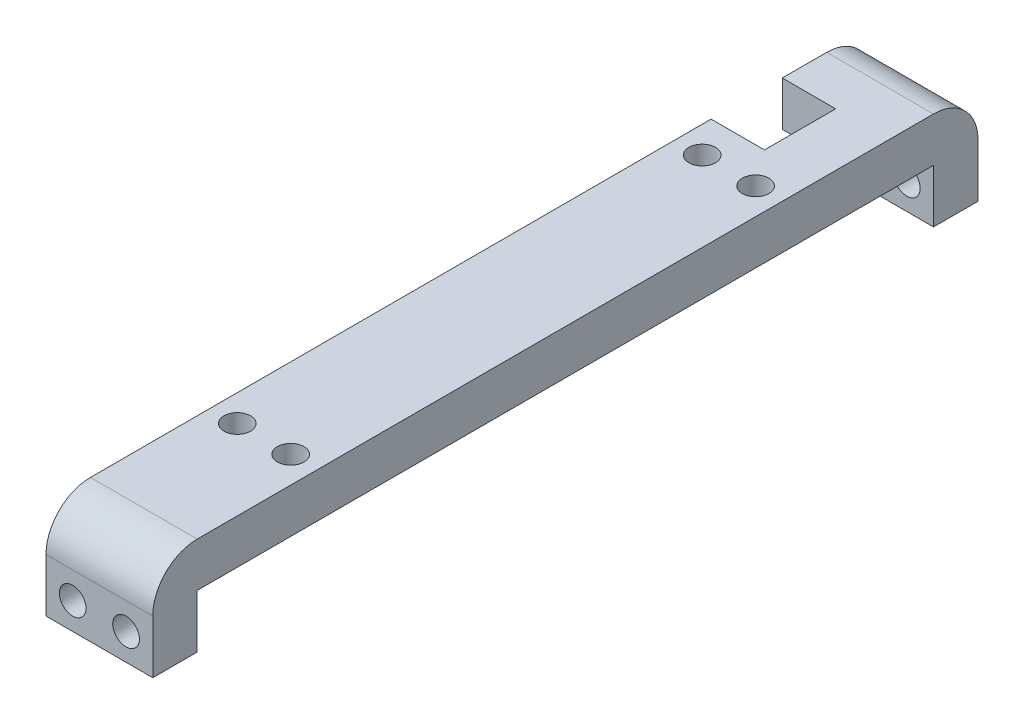
from build123d import *

# Parameters (mm, degrees)
SKETCH1_W      = 12
SKETCH1_H      = 11
EXTRUDE1_DEPTH = 5
SKETCH2_W      = 12
SKETCH2_H      = 5
EXTRUDE2_DEPTH = 82.76
SKETCH3_W      = 12
SKETCH3_H      = 11
EXTRUDE3_DEPTH = 5
EXTRUDE4_REACH = 95.116
SKETCH5_R      = 1.5
SKETCH8_W      = 6
SKETCH8_H      = 8
EXTRUDE5_DEPTH = 5
SKETCH9_R      = 1.5
EXTRUDE6_DEPTH = 5
FILLET1_R      = 5


with BuildPart() as part:
    # Sketch1 → Extrude1 (new body)
    with BuildSketch(Plane.XY):
        Rectangle(SKETCH1_W, SKETCH1_H)
    extrude(amount=EXTRUDE1_DEPTH)

    # Sketch2 → Extrude2 (add)
    with BuildSketch(Plane.XY.offset(5)):
        with Locations((0, 3)):
            Rectangle(SKETCH2_W, SKETCH2_H)
    extrude(amount=EXTRUDE2_DEPTH)

    # Sketch3 → Extrude3 (add)
    with BuildSketch(Plane.XY.offset(87.76)):
        Rectangle(SKETCH3_W, SKETCH3_H)
    extrude(amount=EXTRUDE3_DEPTH)

    # Extrude4: up to this face of the body (flat: up to its plane)
    extrude4_end = Plane(part.part.faces().sort_by_distance((0, 0, 92.76))[0])
    # Sketch5 → Extrude4 (cut, up to the picked face)
    with BuildSketch(Plane(origin=(0, 0, 0), x_dir=(-1, 0, 0), z_dir=(0, 0, -1)), mode=Mode.PRIVATE) as extrude4_sk1:
        with Locations(Location((-3, -2.5, 0), (0, 0, 180))):
            Circle(SKETCH5_R)
    extrude4_tool1 = split(extrude(extrude4_sk1.sketch, amount=-EXTRUDE4_REACH, mode=Mode.PRIVATE), bisect_by=extrude4_end, keep=Keep.BOTH, mode=Mode.PRIVATE)
    # Sketch5 → Extrude4 (cut, up to the picked face)
    with BuildSketch(Plane(origin=(0, 0, 0), x_dir=(-1, 0, 0), z_dir=(0, 0, -1)), mode=Mode.PRIVATE) as extrude4_sk2:
        with Locations(Location((3, -2.5, 0), (0, 0, 180))):
            Circle(SKETCH5_R)
    extrude4_tool2 = split(extrude(extrude4_sk2.sketch, amount=-EXTRUDE4_REACH, mode=Mode.PRIVATE), bisect_by=extrude4_end, keep=Keep.BOTH, mode=Mode.PRIVATE)
    add(extrude4_tool1.solids().sort_by(Axis((3, -2.5, 0), (0, 0, 1)))[0], mode=Mode.SUBTRACT)
    add(extrude4_tool2.solids().sort_by(Axis((-3, -2.5, 0), (0, 0, 1)))[0], mode=Mode.SUBTRACT)

    # Sketch8 → Extrude5 (cut)
    with BuildSketch(Plane(origin=(0, 5.5, 0), x_dir=(1, 0, 0), z_dir=(0, 1, 0))):
        with Locations((-3, -14)):
            Rectangle(SKETCH8_W, SKETCH8_H)
    extrude(amount=-EXTRUDE5_DEPTH, mode=Mode.SUBTRACT)

    # Sketch9 → Extrude6 (cut)
    with BuildSketch(Plane(origin=(0, 5.5, 0), x_dir=(1, 0, 0), z_dir=(0, 1, 0))):
        with Locations(Location((-3, -22, 0), (0, 0, 270))):
            Circle(SKETCH9_R)
        with Locations(Location((3, -22, 0), (0, 0, 270))):
            Circle(SKETCH9_R)
        with Locations(Location((3, -74.26, 0), (0, 0, 270))):
            Circle(SKETCH9_R)
        with Locations(Location((-3, -74.26, 0), (0, 0, 270))):
            Circle(SKETCH9_R)
    extrude(amount=-EXTRUDE6_DEPTH, mode=Mode.SUBTRACT)

    # Fillet1
    fillet1_edges = [part.edges().sort_by_distance(p)[0] for p in [
        (0, 5.5, 92.76),
        (0, 5.5, 0),
    ]]
    fillet(fillet1_edges, radius=FILLET1_R)


solid = part.part
